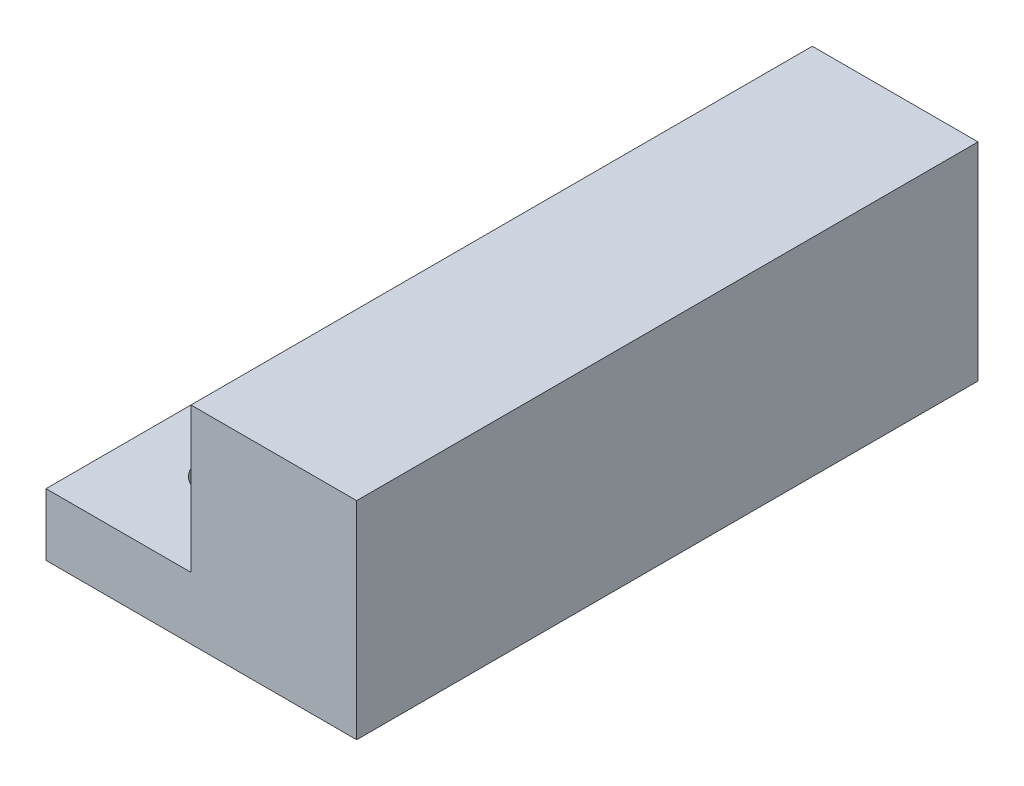
from build123d import *

# Parameters (mm, degrees)
SKETCH1_W           = 19.05
SKETCH1_H           = 38.1
SKETCH1_R           = 1.905
BOSS_EXTRUDE1_DEPTH = 3.81
BOSS_EXTRUDE2_DEPTH = 6.35
SKETCH3_W           = 10.16
SKETCH3_H           = 38.1
BOSS_EXTRUDE3_DEPTH = 2.54
CHAMFER1_SIZE       = 1.27


with BuildPart() as part:
    # Sketch1 → Boss-Extrude1 (new body)
    with BuildSketch(Plane(origin=(0, 0, 0), x_dir=(1, 0, 0), z_dir=(0, 1, 0))):
        with Locations((-4.445, -12.7)):
            Rectangle(SKETCH1_W, SKETCH1_H)
        with Locations(Location((0, 0, 0), (0, 0, 90))):
            Circle(SKETCH1_R, mode=Mode.SUBTRACT)
        with Locations(Location((0, -25.4, 0), (0, 0, 90))):
            Circle(SKETCH1_R, mode=Mode.SUBTRACT)
    extrude(amount=BOSS_EXTRUDE1_DEPTH)

    # Sketch2 → Boss-Extrude2 (add)
    with BuildSketch(Plane(origin=(0, 3.81, 0), x_dir=(1, 0, 0), z_dir=(0, 1, 0))):
        Polygon((-13.97, 6.35), (-13.97, -31.75), (-3.81, -31.75), (-3.81, 6.35), (-6.35, 6.35), (-6.35, -29.21), (-11.43, -29.21), (-11.43, 6.35), align=None)
    extrude(amount=BOSS_EXTRUDE2_DEPTH)

    # Sketch3 → Boss-Extrude3 (add)
    with BuildSketch(Plane(origin=(0, 10.16, 0), x_dir=(1, 0, 0), z_dir=(0, 1, 0))):
        with Locations((-8.89, -12.7)):
            Rectangle(SKETCH3_W, SKETCH3_H)
    extrude(amount=BOSS_EXTRUDE3_DEPTH)

    # Chamfer1
    chamfer1_edges = [part.edges().sort_by_distance(p)[0] for p in [
        (-6.35, 10.16, 11.43),
        (-11.43, 10.16, 11.43),
    ]]
    chamfer(chamfer1_edges, length=CHAMFER1_SIZE)


with BuildPart() as body_2:
    # Mirror1: mirrored copy
    add(part.part.mirror(Plane(origin=(5.08, 3.81, -6.35), x_dir=(0, 0, 1), z_dir=(-1, 0, 0))))


solid = body_2.part
